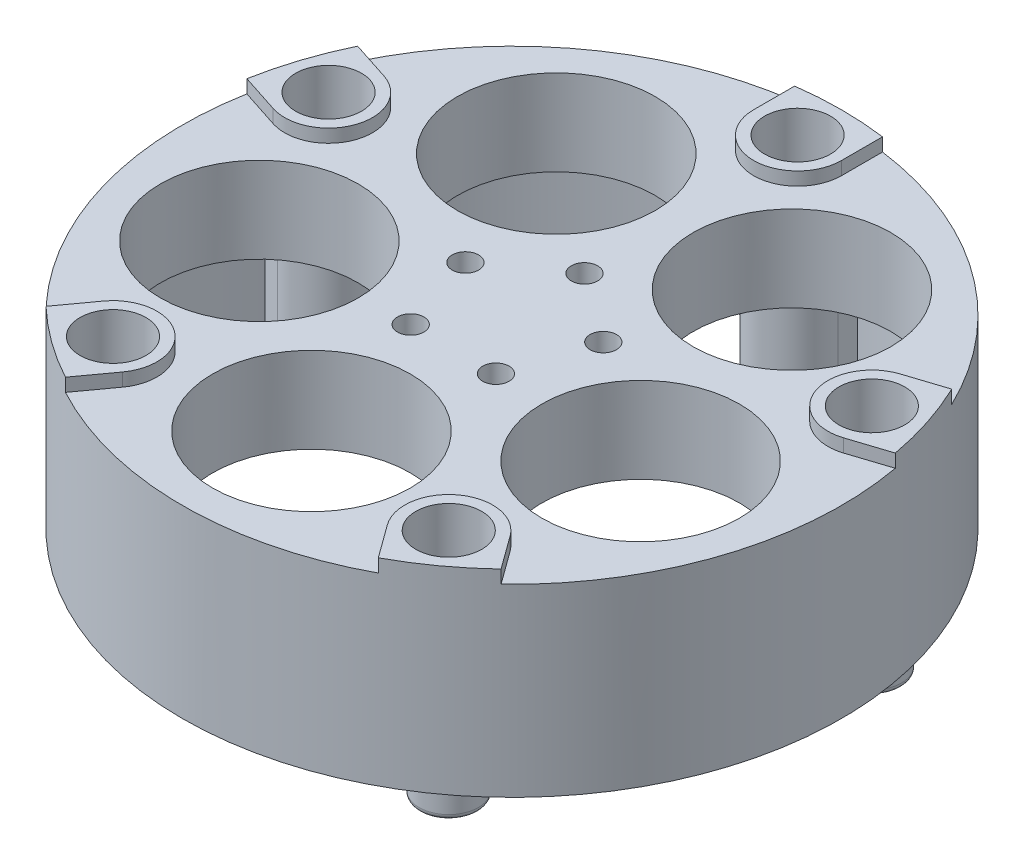
from build123d import *
from build123d.topology import SkipClean

# Parameters (mm, degrees)
SKETCH1_R           = 30
BOSS_EXTRUDE1_DEPTH = 18
CUT_EXTRUDE1_START  = -1.2
SKETCH2_R           = 37.782598
CUT_EXTRUDE1_DEPTH  = 1.2
SKETCH3_R           = 3
CUT_EXTRUDE2_DEPTH  = 9.6
CUT_EXTRUDE4_DEPTH  = 9
SKETCH6_R           = 9
SKETCH6_R_2         = 1.2
CUT_EXTRUDE5_DEPTH  = 44.370497
SKETCH7_R           = 1.2
CUT_EXTRUDE6_DEPTH  = 1.8
SKETCH8_R           = 2.7
BOSS_EXTRUDE2_DEPTH = 3
SKETCH4_R           = 1.6
CUT_EXTRUDE7_DEPTH  = 44.93131
FILLET1_R           = 0.5


with BuildPart() as part:
    # Sketch1 → Boss-Extrude1 (new body)
    with BuildSketch(Plane(origin=(0, 0, 0), x_dir=(1, 0, 0), z_dir=(0, 1, 0))):
        with Locations(Location((0, 0, 0), (0, 0, 270))):
            Circle(SKETCH1_R)
    extrude(amount=BOSS_EXTRUDE1_DEPTH)

    # Sketch2 → Cut-Extrude1 (cut)
    with SkipClean():  # the faces are left unmerged after this step: merging them gives an invalid solid
        with BuildSketch(Plane(origin=(0, 18, 0), x_dir=(1, 0, 0), z_dir=(0, 1, 0)).offset(CUT_EXTRUDE1_START)):
            Circle(SKETCH2_R)
            with BuildLine():
                Line((-4, 26), (-4, 29.732137))
                ThreePointArc((-4, 29.732137), (0, 30), (4, 29.732137))
                Line((4, 29.732137), (4, 26))
                ThreePointArc((4, 26), (0, 22), (-4, 26))
            make_face(mode=Mode.SUBTRACT)
            with BuildLine():
                Line((23.491401, 11.838668), (27.040875, 12.991962))
                ThreePointArc((27.040875, 12.991962), (28.531695, 9.27051), (29.513011, 5.38351))
                Line((29.513011, 5.38351), (25.963537, 4.230216))
                ThreePointArc((25.963537, 4.230216), (20.923243, 6.798374), (23.491401, 11.838668))
            make_face(mode=Mode.SUBTRACT)
            with BuildLine():
                Line((18.518485, -18.683301), (20.71218, -21.702664))
                ThreePointArc((20.71218, -21.702664), (17.633558, -24.27051), (14.240044, -26.404946))
                Line((14.240044, -26.404946), (12.046349, -23.385583))
                ThreePointArc((12.046349, -23.385583), (12.931276, -17.798374), (18.518485, -18.683301))
            make_face(mode=Mode.SUBTRACT)
            with BuildLine():
                Line((-12.046349, -23.385583), (-14.240044, -26.404946))
                ThreePointArc((-14.240044, -26.404946), (-17.633558, -24.27051), (-20.71218, -21.702664))
                Line((-20.71218, -21.702664), (-18.518485, -18.683301))
                ThreePointArc((-18.518485, -18.683301), (-12.931276, -17.798374), (-12.046349, -23.385583))
            make_face(mode=Mode.SUBTRACT)
            with BuildLine():
                Line((-25.963537, 4.230216), (-29.513011, 5.38351))
                ThreePointArc((-29.513011, 5.38351), (-28.531695, 9.27051), (-27.040875, 12.991962))
                Line((-27.040875, 12.991962), (-23.491401, 11.838668))
                ThreePointArc((-23.491401, 11.838668), (-20.923243, 6.798374), (-25.963537, 4.230216))
            make_face(mode=Mode.SUBTRACT)
        extrude(amount=CUT_EXTRUDE1_DEPTH, mode=Mode.SUBTRACT)

    # Sketch3 → Cut-Extrude2 (cut)
    with SkipClean():  # the faces are left unmerged after this step: merging them gives an invalid solid
        with BuildSketch(Plane(origin=(0, 18, 0), x_dir=(1, 0, 0), z_dir=(0, 1, 0))):
            with Locations(Location((0, 26, 0), (0, 0, 270))):
                Circle(SKETCH3_R)
            with Locations(Location((24.727469, 8.034442, 0), (0, 0, 270))):
                Circle(SKETCH3_R)
            with Locations(Location((15.282417, -21.034442, 0), (0, 0, 270))):
                Circle(SKETCH3_R)
            with Locations(Location((-15.282417, -21.034442, 0), (0, 0, 270))):
                Circle(SKETCH3_R)
            with Locations(Location((-24.727469, 8.034442, 0), (0, 0, 270))):
                Circle(SKETCH3_R)
        extrude(amount=-CUT_EXTRUDE2_DEPTH, mode=Mode.SUBTRACT)

    # Sketch5 → Cut-Extrude4 (cut)
    with SkipClean():  # the faces are left unmerged after this step: merging them gives an invalid solid
        with BuildSketch(Plane.XZ):
            with BuildLine():
                Line((3.7, -26), (3.7, -27.754459))
                ThreePointArc((3.7, -27.754459), (16.457987, -22.652476), (25.252696, -12.095509))
                Line((25.252696, -12.095509), (23.584107, -11.553351))
                ThreePointArc((23.584107, -11.553351), (21.20856, -6.891079), (25.870832, -4.515533))
                Line((25.870832, -4.515533), (27.539422, -5.05769))
                ThreePointArc((27.539422, -5.05769), (26.629582, 8.652476), (19.307025, 20.279024))
                Line((19.307025, 20.279024), (18.275779, 18.859636))
                ThreePointArc((18.275779, 18.859636), (13.107611, 18.041079), (12.289054, 23.209247))
                Line((12.289054, 23.209247), (13.320299, 24.628635))
                ThreePointArc((13.320299, 24.628635), (0, 28), (-13.320299, 24.628635))
                Line((-13.320299, 24.628635), (-12.289054, 23.209247))
                ThreePointArc((-12.289054, 23.209247), (-13.107611, 18.041079), (-18.275779, 18.859636))
                Line((-18.275779, 18.859636), (-19.307025, 20.279024))
                ThreePointArc((-19.307025, 20.279024), (-26.629582, 8.652476), (-27.539422, -5.05769))
                Line((-27.539422, -5.05769), (-25.870832, -4.515533))
                ThreePointArc((-25.870832, -4.515533), (-21.20856, -6.891079), (-23.584107, -11.553351))
                Line((-23.584107, -11.553351), (-25.252696, -12.095509))
                ThreePointArc((-25.252696, -12.095509), (-16.457987, -22.652476), (-3.7, -27.754459))
                Line((-3.7, -27.754459), (-3.7, -26))
                ThreePointArc((-3.7, -26), (0, -22.3), (3.7, -26))
            make_face()
        extrude(amount=-CUT_EXTRUDE4_DEPTH, mode=Mode.SUBTRACT)

    # Sketch6 → Cut-Extrude5 (cut, through all)
    with SkipClean():  # the faces are left unmerged after this step: merging them gives an invalid solid
        with BuildSketch(Plane.XZ.offset(-9)):
            with Locations(Location((0, 18.25, 0), (0, 0, 270))):
                Circle(SKETCH6_R)
            with Locations(Location((17.356781, 5.63956, 0), (0, 0, 270))):
                Circle(SKETCH6_R)
            with Locations(Location((10.727081, -14.76456, 0), (0, 0, 270))):
                Circle(SKETCH6_R)
            with Locations(Location((-10.727081, -14.76456, 0), (0, 0, 270))):
                Circle(SKETCH6_R)
            with Locations(Location((-17.356781, 5.63956, 0), (0, 0, 270))):
                Circle(SKETCH6_R)
            with Locations(Location((3.879383, 5.339512, 0), (0, 0, 270))):
                Circle(SKETCH6_R_2)
            with Locations(Location((6.276973, -2.039512, 0), (0, 0, 270))):
                Circle(SKETCH6_R_2)
            with Locations(Location((0, -6.6, 0), (0, 0, 270))):
                Circle(SKETCH6_R_2)
            with Locations(Location((-6.276973, -2.039512, 0), (0, 0, 270))):
                Circle(SKETCH6_R_2)
            with Locations(Location((-3.879383, 5.339512, 0), (0, 0, 270))):
                Circle(SKETCH6_R_2)
        extrude(amount=-CUT_EXTRUDE5_DEPTH, mode=Mode.SUBTRACT)

    # Sketch7 → Cut-Extrude6 (cut)
    with SkipClean():  # the faces are left unmerged after this step: merging them gives an invalid solid
        with BuildSketch(Plane.XZ.offset(-9)):
            with BuildLine():
                ThreePointArc((-2.935277, 8.481472), (0, 8.05), (2.935277, 8.481472))
                ThreePointArc((2.935277, 8.481472), (5.807752, 7.993685), (7.159308, 5.412533))
                ThreePointArc((7.159308, 5.412533), (7.656005, 2.487587), (8.973409, -0.170696))
                ThreePointArc((8.973409, -0.170696), (9.397141, -3.053316), (7.359973, -5.136342))
                ThreePointArc((7.359973, -5.136342), (4.731671, -6.512587), (2.610595, -8.586967))
                ThreePointArc((2.610595, -8.586967), (0, -9.880738), (-2.610595, -8.586967))
                ThreePointArc((-2.610595, -8.586967), (-4.731671, -6.512587), (-7.359973, -5.136342))
                ThreePointArc((-7.359973, -5.136342), (-9.397141, -3.053316), (-8.973409, -0.170696))
                ThreePointArc((-8.973409, -0.170696), (-7.656005, 2.487587), (-7.159308, 5.412533))
                ThreePointArc((-7.159308, 5.412533), (-5.807752, 7.993685), (-2.935277, 8.481472))
            make_face()
            with Locations(Location((-3.879383, 5.339512, 0), (0, 0, 270))):
                Circle(SKETCH7_R, mode=Mode.SUBTRACT)
            with Locations(Location((3.879383, 5.339512, 0), (0, 0, 270))):
                Circle(SKETCH7_R, mode=Mode.SUBTRACT)
            with Locations(Location((6.276973, -2.039512, 0), (0, 0, 270))):
                Circle(SKETCH7_R, mode=Mode.SUBTRACT)
            with Locations(Location((0, -6.6, 0), (0, 0, 270))):
                Circle(SKETCH7_R, mode=Mode.SUBTRACT)
            with Locations(Location((-6.276973, -2.039512, 0), (0, 0, 270))):
                Circle(SKETCH7_R, mode=Mode.SUBTRACT)
        extrude(amount=-CUT_EXTRUDE6_DEPTH, mode=Mode.SUBTRACT)

    # Sketch8 → Boss-Extrude2 (add)
    with SkipClean():  # the faces are left unmerged after this step: merging them gives an invalid solid
        with BuildSketch(Plane.XZ):
            with Locations(Location((0, -26, 0), (0, 0, 90))):
                Circle(SKETCH8_R)
            with Locations(Location((-24.727469, -8.034442, 0), (0, 0, 90))):
                Circle(SKETCH8_R)
            with Locations(Location((-15.282417, 21.034442, 0), (0, 0, 90))):
                Circle(SKETCH8_R)
            with Locations(Location((15.282417, 21.034442, 0), (0, 0, 90))):
                Circle(SKETCH8_R)
            with Locations(Location((24.727469, -8.034442, 0), (0, 0, 90))):
                Circle(SKETCH8_R)
        extrude(amount=BOSS_EXTRUDE2_DEPTH)

    # Sketch4 → Cut-Extrude7 (cut, through all)
    with SkipClean():  # the faces are left unmerged after this step: merging them gives an invalid solid
        with BuildSketch(Plane(origin=(0, 8.4, 0), x_dir=(1, 0, 0), z_dir=(0, 1, 0))):
            with Locations(Location((0, 26, 0), (0, 0, 270))):
                Circle(SKETCH4_R)
            with Locations(Location((24.727469, 8.034442, 0), (0, 0, 270))):
                Circle(SKETCH4_R)
            with Locations(Location((15.282417, -21.034442, 0), (0, 0, 270))):
                Circle(SKETCH4_R)
            with Locations(Location((-15.282417, -21.034442, 0), (0, 0, 270))):
                Circle(SKETCH4_R)
            with Locations(Location((-24.727469, 8.034442, 0), (0, 0, 270))):
                Circle(SKETCH4_R)
        extrude(amount=-CUT_EXTRUDE7_DEPTH, mode=Mode.SUBTRACT)

    # Fillet1
    fillet1_edges = [part.edges().sort_by_distance(p)[0] for p in [
        (0, -3, -28.7),
        (-24.727469, -3, -10.734442),
        (-15.282417, -3, 18.334442),
        (15.282417, -3, 18.334442),
        (24.727469, -3, -10.734442),
    ]]
    fillet(fillet1_edges, radius=FILLET1_R)


solid = part.part
